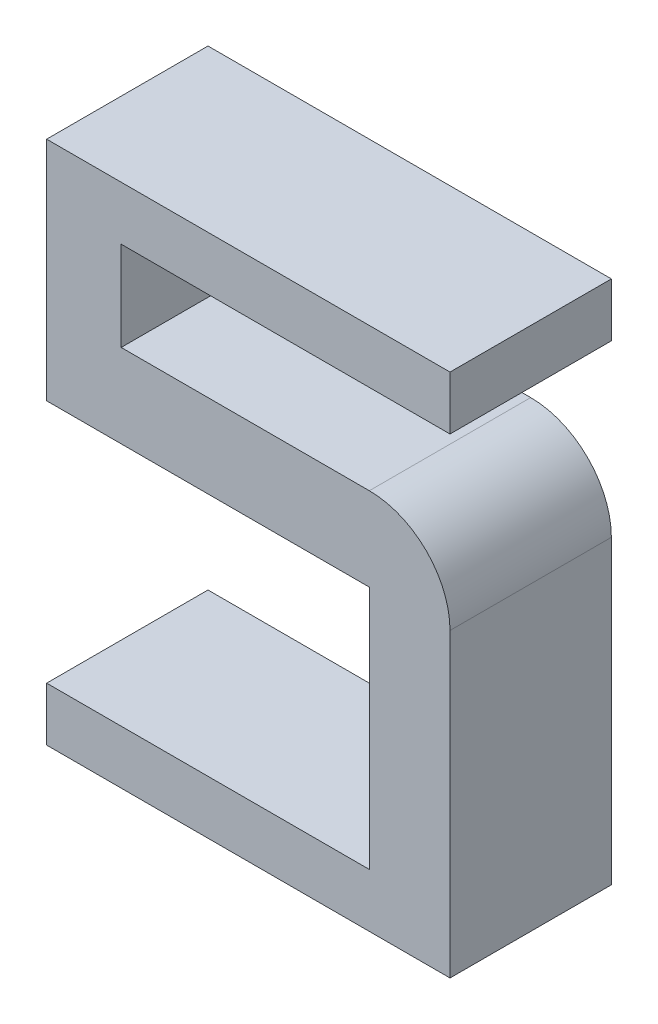
from build123d import *

# Parameters (mm, degrees)
BOSS_EXTRUDE1_DEPTH = 20


with BuildPart() as part:
    # Sketch1 → Boss-Extrude1 (new body)
    with BuildSketch(Plane.XY):
        with BuildLine():
            Line((130.834806192, 133.228481614), (80.834806192, 133.228481614))
            Line((80.834806192, 133.228481614), (80.834806192, 105.140286594))
            Line((80.834806192, 105.140286594), (120.834806192, 105.140286594))
            Line((120.834806192, 105.140286594), (120.834806192, 74.834602493))
            Line((120.834806192, 74.834602493), (80.834806192, 74.834602493))
            Line((80.834806192, 74.834602493), (80.834806192, 68.182135251))
            Line((80.834806192, 68.182135251), (130.834806192, 68.182135251))
            Line((130.834806192, 68.182135251), (130.834806192, 105.488568969))
            ThreePointArc((130.834806192, 105.488568969), (127.905874004, 112.559636781), (120.834806192, 115.488568969))
            Line((120.834806192, 115.488568969), (90.074344028, 115.488568969))
            Line((90.074344028, 115.488568969), (90.074344028, 126.576014372))
            Line((90.074344028, 126.576014372), (130.834806192, 126.576014372))
            Line((130.834806192, 126.576014372), (130.834806192, 133.228481614))
        make_face()
    extrude(amount=BOSS_EXTRUDE1_DEPTH)


solid = part.part
